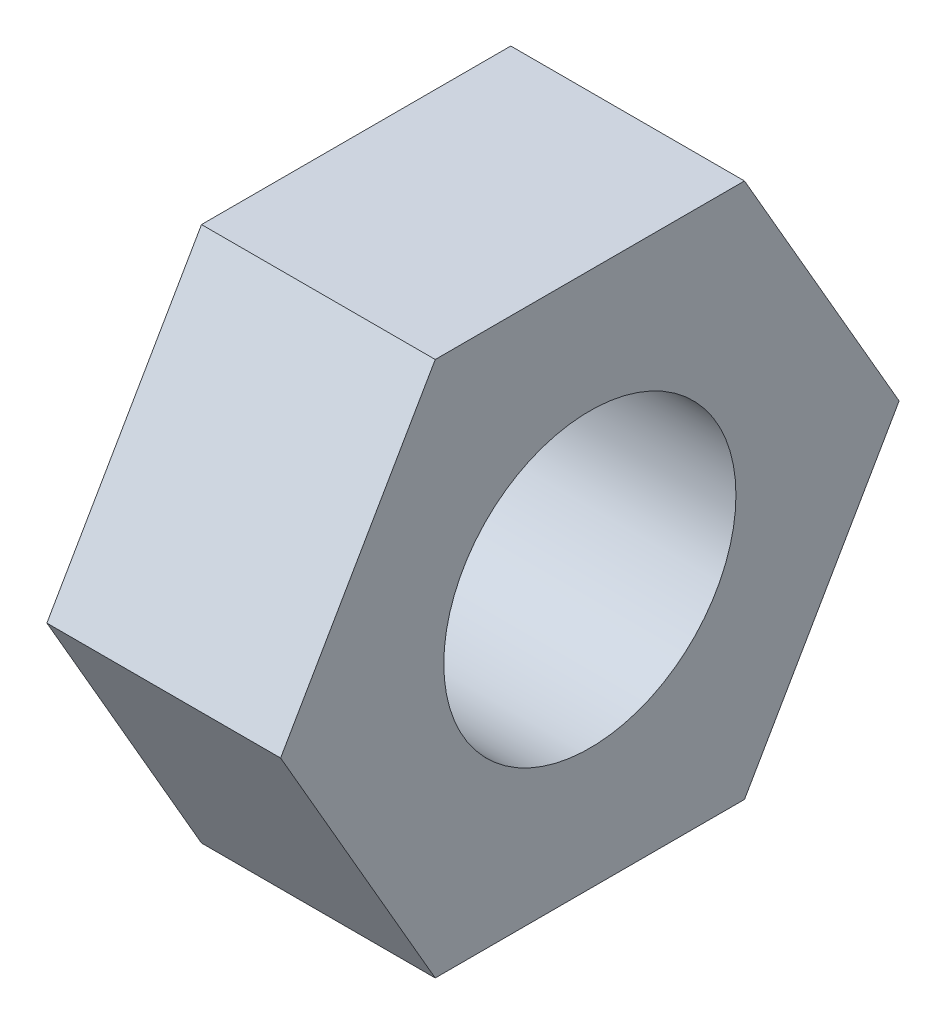
from build123d import *

# Parameters (mm, degrees)
M3_NUT_BLANK_DEPTH          = 2.4
M3_THREAD_ENVELOPE_SKETCH_R = 1.5
M3_THREAD_ENVELOPE_DEPTH    = 2.6


with BuildPart() as part:
    # M3 nut blank sketch → M3 nut blank (new body)
    with BuildSketch(Plane(origin=(20.7, 0, 0), x_dir=(0, 0, -1), z_dir=(1, 0, 0))):
        Polygon((9.91228676, -35.25), (8.324573519, -38), (9.91228676, -40.75), (13.08771324, -40.75), (14.675426481, -38), (13.08771324, -35.25), align=None)
    extrude(amount=M3_NUT_BLANK_DEPTH)

    # M3 thread envelope sketch → M3 thread envelope (cut)
    with BuildSketch(Plane(origin=(20.6, 0, 0), x_dir=(0, 0, -1), z_dir=(1, 0, 0))):
        with Locations((11.5, -38)):
            Circle(M3_THREAD_ENVELOPE_SKETCH_R)
    extrude(amount=M3_THREAD_ENVELOPE_DEPTH, mode=Mode.SUBTRACT)


solid = part.part
